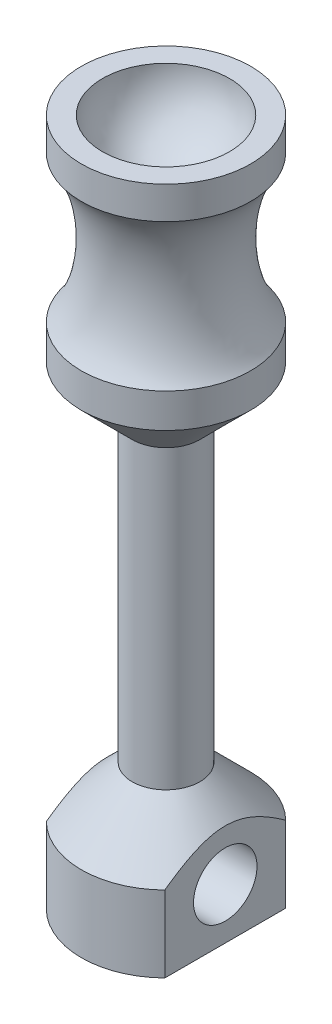
from build123d import *

# Parameters (mm, degrees)
SKETCH1_R                      = 6.35
BOSS_EXTRUDE1_DEPTH            = 54.102
SKETCH3_W                      = 6.35
SKETCH3_H                      = 14.605
CUT_EXTRUDE1_DEPTH             = 55.842241056
F_3_16_0_1875_DIAMETER_HOLE1_D = 4.7625
SKETCH7_RX                     = 6.35
SKETCH7_RY                     = 3.175
CUT_EXTRUDE2_DEPTH             = 56.532701566
CUT_EXTRUDE2_DEPTH_BACK        = 56.532701566
SKETCH9_W                      = 25.4
SKETCH9_H                      = 12.7


with BuildPart() as part:
    # Sketch1 → Boss-Extrude1 (new body)
    with BuildSketch(Plane(origin=(0, 0, 0), x_dir=(1, 0, 0), z_dir=(0, 1, 0))):
        with Locations(Location((0, 0, 0), (0, 0, 270))):
            Circle(SKETCH1_R)
    extrude(amount=BOSS_EXTRUDE1_DEPTH)

    # Sketch2 → Cut-Revolve1 (revolve, cut)
    with BuildSketch(Plane.XY, mode=Mode.PRIVATE) as cut_revolve1_sk:
        Polygon((26.057124612, 38.1), (6.35, 38.1), (2.54, 34.29), (2.54, 12.065), (6.35, 8.255), (26.057124612, 8.255), align=None)
    revolve(cut_revolve1_sk.sketch.rotate(Axis((0, 0, 0), (0, 1, 0)), 90), axis=Axis((0, 0, 0), (0, 1, 0)), mode=Mode.SUBTRACT)

    # Sketch3 → Cut-Extrude1 (cut, symmetric)
    with BuildSketch(Plane.XY):
        with Locations((7.62, 7.3025)):
            Rectangle(SKETCH3_W, SKETCH3_H)
    cut_extrude1 = extrude(amount=CUT_EXTRUDE1_DEPTH, both=True, mode=Mode.SUBTRACT)

    # Mirror1: Cut-Extrude1 across plane
    add(cut_extrude1.mirror(Plane(origin=(0, 0, 0), x_dir=(0, 0, 1), z_dir=(1, 0, 0))), mode=Mode.SUBTRACT)

    # 3/16 (0.1875) Diameter Hole1 (through all)
    with Locations(Plane.ZY.offset(4.445)):
        with Locations((0, 6.35)):
            Hole(F_3_16_0_1875_DIAMETER_HOLE1_D / 2)

    # Sketch7 → Cut-Revolve2 (revolve, cut)
    with BuildSketch(Plane.XY, mode=Mode.PRIVATE) as cut_revolve2_sk:
        with Locations(Location((7.9375, 46.1645), (0, 0, -90))):
            Ellipse(SKETCH7_RX, SKETCH7_RY)
    revolve(cut_revolve2_sk.sketch.rotate(Axis((0, 0, 0), (0, 1, 0)), 90), axis=Axis((0, 0, 0), (0, 1, 0)), mode=Mode.SUBTRACT)

    # Sketch8 → Cut-Revolve3 (revolve, cut)
    with BuildSketch(Plane(origin=(0, 0, 0), x_dir=(0, 0, -1), z_dir=(1, 0, 0))):
        with BuildLine():
            Line((4.7625, 54.102), (-4.7625, 54.102))
            ThreePointArc((-4.7625, 54.102), (0, 49.3395), (4.7625, 54.102))
        make_face()
    revolve(axis=Axis((0, 54.102, -4.7625), (0, 0, 1)), mode=Mode.SUBTRACT)

    # Sketch9 → Cut-Extrude2 (cut, two sides: drawn at the far end of the back side and taken through both)
    with BuildSketch(Plane(origin=(4.445, 0, 0), x_dir=(0, 0, -1), z_dir=(1, 0, 0)).offset(-CUT_EXTRUDE2_DEPTH_BACK)):
        with Locations((1.492425813, -3.81)):
            Rectangle(SKETCH9_W, SKETCH9_H)
    extrude(amount=CUT_EXTRUDE2_DEPTH + CUT_EXTRUDE2_DEPTH_BACK, mode=Mode.SUBTRACT)


solid = part.part
